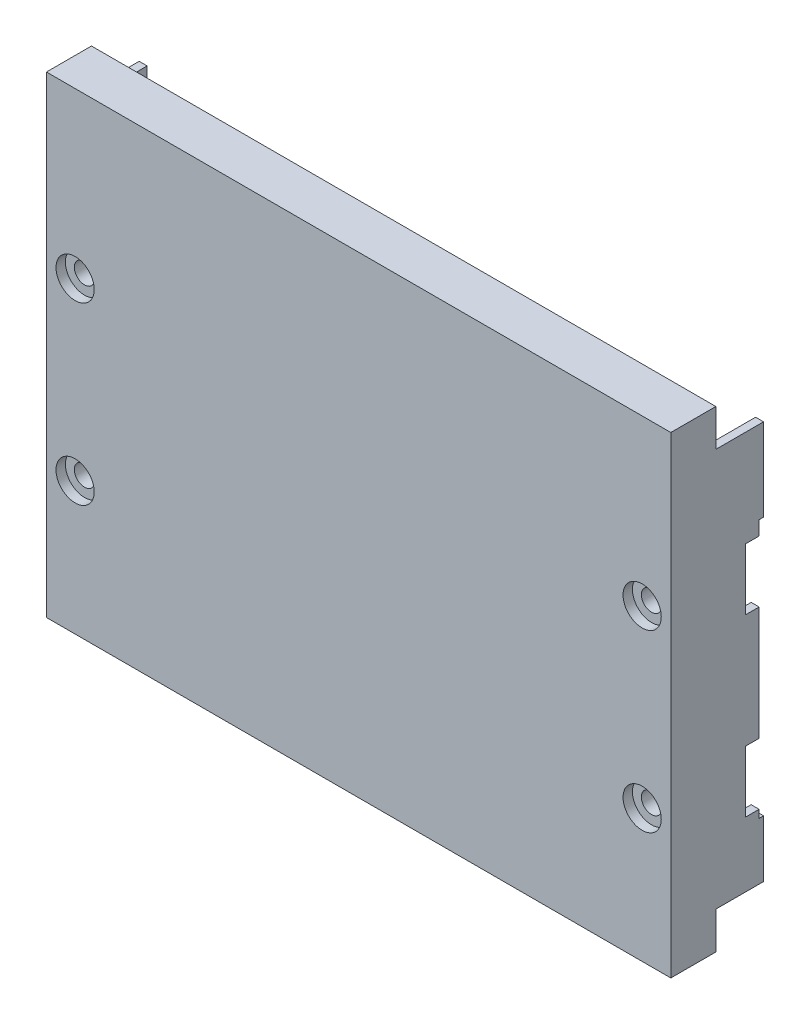
from build123d import *

# Parameters (mm, degrees)
SKETCH1_W                      = 99.568
SKETCH1_H                      = 63.5
BASE_DEPTH                     = 5.08
SKETCH2_W                      = 96.52
SKETCH2_H                      = 60.452
HOLLOW_DEPTH                   = 2.000000064
SKETCH3_W                      = 1.27
SKETCH3_H                      = 63.5
END_PIECES_DEPTH               = 9.000000034
SKETCH7_W                      = 2.201400112
SKETCH7_H                      = 9.798
WHERE_TOP_INTRUDES_DEPTH       = 106.932019925
CABLE_STOP_WINGS_ALT_W         = 99.568
CABLE_STOP_WINGS_ALT_H         = 5
CABLE_STOP_WING_BOSS_ALT_DEPTH = 1.500000048
SKETCH4_R                      = 3.175
SCREW_BOSSES_DEPTH             = 2.000000064
SKETCH5_R                      = 1.6256
SCREW_HOLES_DEPTH              = 80.026797047
SKETCH6_R                      = 3.048
COUNTER_SINK_DEPTH             = 1.500000048
SKETCH25_W                     = 99.568
SKETCH25_H                     = 4.5
BOX_UNDER_CONNECTORS_DEPTH     = 7.1786
SKETCH26_W                     = 7.1786
SKETCH26_H                     = 75.34
FILL_ENDS_DEPTH                = 1.5
FILL_START                     = -99.568
SKETCH26_2_W                   = 7.1786
SKETCH26_2_H                   = 75.34
FILL_THE_OTHER_END_DEPTH       = 1.5
BOSS_EXTRUDE4_START            = -1.27
SKETCH27_W                     = 0.708599966
SKETCH27_H                     = 9.088
SKETCH27_H_2                   = 13.169
BOSS_EXTRUDE4_DEPTH            = 1.27
BOSS_EXTRUDE5_START            = -99.568
SKETCH27_2_W                   = 0.708599966
SKETCH27_2_H                   = 9.088
SKETCH27_2_H_2                 = 13.169
BOSS_EXTRUDE5_DEPTH            = 1.270001


with BuildPart() as part:
    # Sketch1 → base (new body)
    with BuildSketch(Plane.XY):
        with Locations((17.75984127, 3.275793651)):
            Rectangle(SKETCH1_W, SKETCH1_H)
    extrude(amount=BASE_DEPTH)

    # Sketch2 → hollow (cut)
    with BuildSketch(Plane(origin=(0, 0, 0), x_dir=(-1, 0, 0), z_dir=(0, 0, -1))):
        with Locations((-17.75984127, 3.275793651)):
            Rectangle(SKETCH2_W, SKETCH2_H)
    extrude(amount=-HOLLOW_DEPTH, mode=Mode.SUBTRACT)

    # Sketch3 → end pieces (add)
    with BuildSketch(Plane(origin=(0, 0, 0), x_dir=(-1, 0, 0), z_dir=(0, 0, -1))):
        with Locations((31.38915873, 3.275793651)):
            Rectangle(SKETCH3_W, SKETCH3_H)
        with Locations((-66.90884127, 3.275793651)):
            Rectangle(SKETCH3_W, SKETCH3_H)
    extrude(amount=END_PIECES_DEPTH)

    # Sketch7 → where top intrudes (cut, through all)
    with BuildSketch(Plane(origin=(67.54384127, 0, 0), x_dir=(0, 0, -1), z_dir=(1, 0, 0))):
        with Locations((7.899299978, 14.705793651)):
            Rectangle(SKETCH7_W, SKETCH7_H)
        with Locations((7.899299978, -13.234206349)):
            Rectangle(SKETCH7_W, SKETCH7_H)
    extrude(amount=-WHERE_TOP_INTRUDES_DEPTH, mode=Mode.SUBTRACT)

    # cable stop wings alt → cable stop wing boss alt (add)
    with BuildSketch(Plane.XY.offset(5.08)):
        with Locations((17.75984127, -30.974206349)):
            Rectangle(CABLE_STOP_WINGS_ALT_W, CABLE_STOP_WINGS_ALT_H)
        with Locations((17.75984127, 37.525793651)):
            Rectangle(CABLE_STOP_WINGS_ALT_W, CABLE_STOP_WINGS_ALT_H)
    extrude(amount=-CABLE_STOP_WING_BOSS_ALT_DEPTH)

    # Sketch4 → screw bosses (add)
    with BuildSketch(Plane(origin=(0, 0, 2.000000064), x_dir=(-1, 0, 0), z_dir=(0, 0, -1))):
        with Locations((-62.97184127, 14.705793651)):
            Circle(SKETCH4_R)
        with Locations((-62.97184127, -13.234206349)):
            Circle(SKETCH4_R)
        with Locations((27.45215873, -13.234206349)):
            Circle(SKETCH4_R)
        with Locations((27.45215873, 14.705793651)):
            Circle(SKETCH4_R)
    extrude(amount=SCREW_BOSSES_DEPTH)

    # Sketch5 → screw holes (cut, through all)
    with BuildSketch(Plane(origin=(0, 0, 0), x_dir=(-1, 0, 0), z_dir=(0, 0, -1))):
        with Locations((-62.97184127, 14.705793651)):
            Circle(SKETCH5_R)
        with Locations((-62.97184127, -13.234206349)):
            Circle(SKETCH5_R)
        with Locations((27.45215873, 14.705793651)):
            Circle(SKETCH5_R)
        with Locations((27.45215873, -13.234206349)):
            Circle(SKETCH5_R)
    extrude(amount=-SCREW_HOLES_DEPTH, mode=Mode.SUBTRACT)

    # Sketch6 → counter sink (cut)
    with BuildSketch(Plane.XY.offset(5.08)):
        with Locations((62.97184127, -13.234206349)):
            Circle(SKETCH6_R)
        with Locations((62.97184127, 14.705793651)):
            Circle(SKETCH6_R)
        with Locations((-27.45215873, -13.234206349)):
            Circle(SKETCH6_R)
        with Locations((-27.45215873, 14.705793651)):
            Circle(SKETCH6_R)
    extrude(amount=-COUNTER_SINK_DEPTH, mode=Mode.SUBTRACT)

    # Sketch25 → box under connectors (add)
    with BuildSketch(Plane.XY.offset(5.08)):
        with Locations((17.75984127, 38.695793651)):
            Rectangle(SKETCH25_W, SKETCH25_H)
        with Locations((17.75984127, -32.144206349)):
            Rectangle(SKETCH25_W, SKETCH25_H)
    extrude(amount=-BOX_UNDER_CONNECTORS_DEPTH)

    # Sketch26 → Fill ends (add)
    with BuildSketch(Plane.ZY.offset(32.02415873)):
        with Locations((1.4907, 3.275793651)):
            Rectangle(SKETCH26_W, SKETCH26_H)
    extrude(amount=-FILL_ENDS_DEPTH)

    # Sketch26<2> → Fill the other end (add)
    with BuildSketch(Plane.ZY.offset(32.02415873).offset(FILL_START)):
        with Locations((1.4907, 3.275793651)):
            Rectangle(SKETCH26_2_W, SKETCH26_2_H)
    extrude(amount=FILL_THE_OTHER_END_DEPTH)

    # Sketch27 → Boss-Extrude4 (add)
    with BuildSketch(Plane.ZY.offset(32.02415873).offset(BOSS_EXTRUDE4_START)):
        with Locations((-9.354300017, -23.930206349)):
            Rectangle(SKETCH27_W, SKETCH27_H)
        with Locations((-9.354300017, 28.441293651)):
            Rectangle(SKETCH27_W, SKETCH27_H_2)
    extrude(amount=BOSS_EXTRUDE4_DEPTH)

    # Sketch27<2> → Boss-Extrude5 (add)
    with BuildSketch(Plane.ZY.offset(32.02415873).offset(BOSS_EXTRUDE5_START)):
        with Locations((-9.354300017, -23.930206349)):
            Rectangle(SKETCH27_2_W, SKETCH27_2_H)
        with Locations((-9.354300017, 28.441293651)):
            Rectangle(SKETCH27_2_W, SKETCH27_2_H_2)
    extrude(amount=BOSS_EXTRUDE5_DEPTH)


solid = part.part
